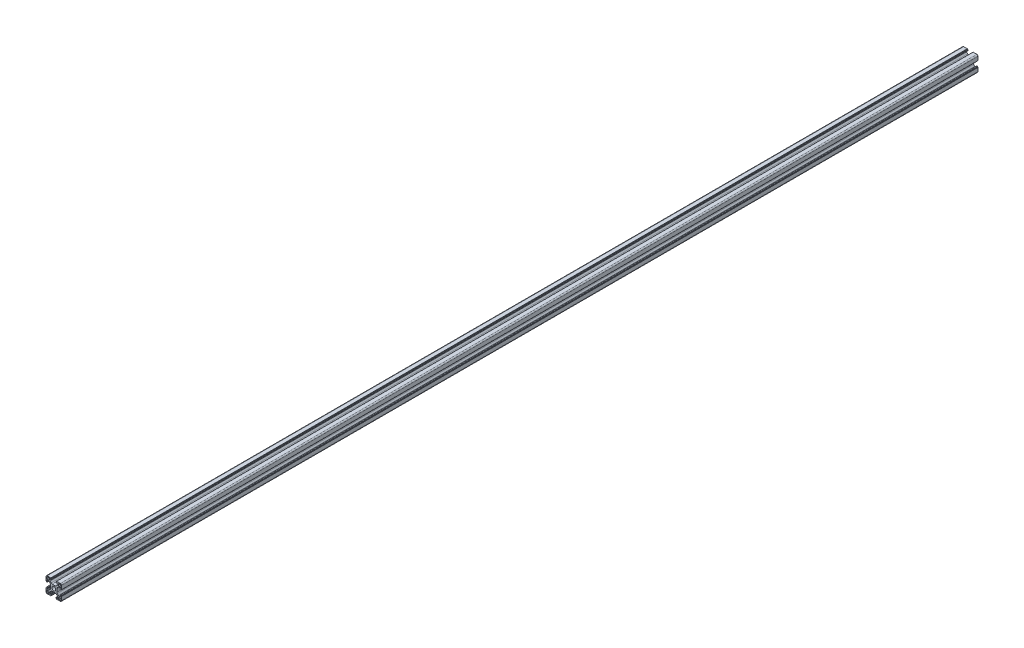
from build123d import *

# Parameters (mm, degrees)
EXTRUDE_1_DEPTH = 1180


with BuildPart() as part:
    # Эскиз1 → Бобышка-Вытянуть1 (new body)
    with BuildSketch(Plane.XY):
        with BuildLine():
            Line((-34.993325654, 64.172801362), (-33.094544985, 64.172801362))
            ThreePointArc((-33.094544985, 64.172801362), (-32.32917812, 64.325042297), (-31.680331423, 64.758587799))
            Line((-31.680331423, 64.758587799), (-30.379112092, 66.05980713))
            ThreePointArc((-30.379112092, 66.05980713), (-29.945566589, 66.708653828), (-29.793325654, 67.474020692))
            Line((-29.793325654, 67.474020692), (-29.793325654, 68.372801362))
            ThreePointArc((-29.793325654, 68.372801362), (-29.939772264, 68.726354752), (-30.293325654, 68.872801362))
            Line((-30.293325654, 68.872801362), (-30.396218873, 68.872801362))
            ThreePointArc((-30.396218873, 68.872801362), (-30.587560589, 68.834741128), (-30.749772264, 68.726354752))
            Line((-30.749772264, 68.726354752), (-31.23010235, 68.246024666))
            ThreePointArc((-31.23010235, 68.246024666), (-31.311208187, 68.191831478), (-31.406879045, 68.172801362))
            Line((-31.406879045, 68.172801362), (-31.693325654, 68.172801362))
            ThreePointArc((-31.693325654, 68.172801362), (-31.87010235, 68.246024666), (-31.943325654, 68.422801362))
            Line((-31.943325654, 68.422801362), (-31.943325654, 69.571872182))
            ThreePointArc((-31.943325654, 69.571872182), (-31.899391671, 69.677938199), (-31.793325654, 69.721872182))
            Line((-31.793325654, 69.721872182), (-31.293325654, 69.721872182))
            Line((-31.293325654, 69.721872182), (-31.293325654, 70.022801362))
            ThreePointArc((-31.293325654, 70.022801362), (-31.249391671, 70.128867379), (-31.143325654, 70.172801362))
            Line((-31.143325654, 70.172801362), (-26.493325654, 70.172801362))
            ThreePointArc((-26.493325654, 70.172801362), (-25.432665483, 69.733461533), (-24.993325654, 68.672801362))
            Line((-24.993325654, 68.672801362), (-24.993325654, 64.022801362))
            ThreePointArc((-24.993325654, 64.022801362), (-25.037259637, 63.916735344), (-25.143325654, 63.872801362))
            Line((-25.143325654, 63.872801362), (-25.444254834, 63.872801362))
            Line((-25.444254834, 63.872801362), (-25.444254834, 63.372801362))
            ThreePointArc((-25.444254834, 63.372801362), (-25.488188817, 63.266735344), (-25.594254834, 63.222801362))
            Line((-25.594254834, 63.222801362), (-26.743325654, 63.222801362))
            ThreePointArc((-26.743325654, 63.222801362), (-26.92010235, 63.296024666), (-26.993325654, 63.472801362))
            Line((-26.993325654, 63.472801362), (-26.993325654, 63.759247971))
            ThreePointArc((-26.993325654, 63.759247971), (-26.974295537, 63.854918829), (-26.92010235, 63.936024666))
            Line((-26.92010235, 63.936024666), (-26.439772264, 64.416354752))
            ThreePointArc((-26.439772264, 64.416354752), (-26.331385888, 64.578566427), (-26.293325654, 64.769908143))
            Line((-26.293325654, 64.769908143), (-26.293325654, 64.872801362))
            ThreePointArc((-26.293325654, 64.872801362), (-26.439772264, 65.226354752), (-26.793325654, 65.372801362))
            Line((-26.793325654, 65.372801362), (-27.692106323, 65.372801362))
            ThreePointArc((-27.692106323, 65.372801362), (-28.457473188, 65.220560427), (-29.106319886, 64.787014924))
            Line((-29.106319886, 64.787014924), (-30.407539217, 63.485795593))
            ThreePointArc((-30.407539217, 63.485795593), (-30.841084719, 62.836948895), (-30.993325654, 62.071582031))
            Line((-30.993325654, 62.071582031), (-30.993325654, 60.172801362))
            Line((-30.993325654, 60.172801362), (-30.993325654, 58.274020692))
            ThreePointArc((-30.993325654, 58.274020692), (-30.841084719, 57.508653828), (-30.407539217, 56.85980713))
            Line((-30.407539217, 56.85980713), (-29.106319886, 55.558587799))
            ThreePointArc((-29.106319886, 55.558587799), (-28.457473188, 55.125042297), (-27.692106323, 54.972801362))
            Line((-27.692106323, 54.972801362), (-26.793325654, 54.972801362))
            ThreePointArc((-26.793325654, 54.972801362), (-26.439772264, 55.119247971), (-26.293325654, 55.472801362))
            Line((-26.293325654, 55.472801362), (-26.293325654, 55.57569458))
            ThreePointArc((-26.293325654, 55.57569458), (-26.331385888, 55.767036297), (-26.439772264, 55.929247971))
            Line((-26.439772264, 55.929247971), (-26.92010235, 56.409578057))
            ThreePointArc((-26.92010235, 56.409578057), (-26.974295537, 56.490683894), (-26.993325654, 56.586354752))
            Line((-26.993325654, 56.586354752), (-26.993325654, 56.872801362))
            ThreePointArc((-26.993325654, 56.872801362), (-26.92010235, 57.049578057), (-26.743325654, 57.122801362))
            Line((-26.743325654, 57.122801362), (-25.594254834, 57.122801362))
            ThreePointArc((-25.594254834, 57.122801362), (-25.488188817, 57.078867379), (-25.444254834, 56.972801362))
            Line((-25.444254834, 56.972801362), (-25.444254834, 56.472801362))
            Line((-25.444254834, 56.472801362), (-25.143325654, 56.472801362))
            ThreePointArc((-25.143325654, 56.472801362), (-25.037259637, 56.428867379), (-24.993325654, 56.322801362))
            Line((-24.993325654, 56.322801362), (-24.993325654, 51.672801362))
            ThreePointArc((-24.993325654, 51.672801362), (-25.432665483, 50.61214119), (-26.493325654, 50.172801362))
            Line((-26.493325654, 50.172801362), (-31.143325654, 50.172801362))
            ThreePointArc((-31.143325654, 50.172801362), (-31.249391671, 50.216735344), (-31.293325654, 50.322801362))
            Line((-31.293325654, 50.322801362), (-31.293325654, 50.623730541))
            Line((-31.293325654, 50.623730541), (-31.793325654, 50.623730541))
            ThreePointArc((-31.793325654, 50.623730541), (-31.899391671, 50.667664524), (-31.943325654, 50.773730541))
            Line((-31.943325654, 50.773730541), (-31.943325654, 51.922801362))
            ThreePointArc((-31.943325654, 51.922801362), (-31.87010235, 52.099578057), (-31.693325654, 52.172801362))
            Line((-31.693325654, 52.172801362), (-31.406879045, 52.172801362))
            ThreePointArc((-31.406879045, 52.172801362), (-31.311208187, 52.153771245), (-31.23010235, 52.099578057))
            Line((-31.23010235, 52.099578057), (-30.749772264, 51.619247971))
            ThreePointArc((-30.749772264, 51.619247971), (-30.587560589, 51.510861595), (-30.396218873, 51.472801362))
            Line((-30.396218873, 51.472801362), (-30.293325654, 51.472801362))
            ThreePointArc((-30.293325654, 51.472801362), (-29.939772264, 51.619247971), (-29.793325654, 51.972801362))
            Line((-29.793325654, 51.972801362), (-29.793325654, 52.871582031))
            ThreePointArc((-29.793325654, 52.871582031), (-29.945566589, 53.636948895), (-30.379112092, 54.285795593))
            Line((-30.379112092, 54.285795593), (-31.680331423, 55.587014924))
            ThreePointArc((-31.680331423, 55.587014924), (-32.32917812, 56.020560427), (-33.094544985, 56.172801362))
            Line((-33.094544985, 56.172801362), (-34.993325654, 56.172801362))
            Line((-34.993325654, 56.172801362), (-36.892106323, 56.172801362))
            ThreePointArc((-36.892106323, 56.172801362), (-37.657473188, 56.020560427), (-38.306319886, 55.587014924))
            Line((-38.306319886, 55.587014924), (-39.607539217, 54.285795593))
            ThreePointArc((-39.607539217, 54.285795593), (-40.041084719, 53.636948895), (-40.193325654, 52.871582031))
            Line((-40.193325654, 52.871582031), (-40.193325654, 51.972801362))
            ThreePointArc((-40.193325654, 51.972801362), (-40.046879045, 51.619247971), (-39.693325654, 51.472801362))
            Line((-39.693325654, 51.472801362), (-39.590432436, 51.472801362))
            ThreePointArc((-39.590432436, 51.472801362), (-39.399090719, 51.510861595), (-39.236879045, 51.619247971))
            Line((-39.236879045, 51.619247971), (-38.756548959, 52.099578057))
            ThreePointArc((-38.756548959, 52.099578057), (-38.675443122, 52.153771245), (-38.579772264, 52.172801362))
            Line((-38.579772264, 52.172801362), (-38.293325654, 52.172801362))
            ThreePointArc((-38.293325654, 52.172801362), (-38.116548959, 52.099578057), (-38.043325654, 51.922801362))
            Line((-38.043325654, 51.922801362), (-38.043325654, 50.773730541))
            ThreePointArc((-38.043325654, 50.773730541), (-38.087259637, 50.667664524), (-38.193325654, 50.623730541))
            Line((-38.193325654, 50.623730541), (-38.693325654, 50.623730541))
            Line((-38.693325654, 50.623730541), (-38.693325654, 50.322801362))
            ThreePointArc((-38.693325654, 50.322801362), (-38.737259637, 50.216735344), (-38.843325654, 50.172801362))
            Line((-38.843325654, 50.172801362), (-43.493325654, 50.172801362))
            ThreePointArc((-43.493325654, 50.172801362), (-44.553985826, 50.61214119), (-44.993325654, 51.672801362))
            Line((-44.993325654, 51.672801362), (-44.993325654, 56.322801362))
            ThreePointArc((-44.993325654, 56.322801362), (-44.949391671, 56.428867379), (-44.843325654, 56.472801362))
            Line((-44.843325654, 56.472801362), (-44.542396475, 56.472801362))
            Line((-44.542396475, 56.472801362), (-44.542396475, 56.972801362))
            ThreePointArc((-44.542396475, 56.972801362), (-44.498462492, 57.078867379), (-44.392396475, 57.122801362))
            Line((-44.392396475, 57.122801362), (-43.243325654, 57.122801362))
            ThreePointArc((-43.243325654, 57.122801362), (-43.066548959, 57.049578057), (-42.993325654, 56.872801362))
            Line((-42.993325654, 56.872801362), (-42.993325654, 56.586354752))
            ThreePointArc((-42.993325654, 56.586354752), (-43.012355771, 56.490683894), (-43.066548959, 56.409578057))
            Line((-43.066548959, 56.409578057), (-43.546879045, 55.929247971))
            ThreePointArc((-43.546879045, 55.929247971), (-43.655265421, 55.767036297), (-43.693325654, 55.57569458))
            Line((-43.693325654, 55.57569458), (-43.693325654, 55.472801362))
            ThreePointArc((-43.693325654, 55.472801362), (-43.546879045, 55.119247971), (-43.193325654, 54.972801362))
            Line((-43.193325654, 54.972801362), (-42.294544985, 54.972801362))
            ThreePointArc((-42.294544985, 54.972801362), (-41.52917812, 55.125042297), (-40.880331423, 55.558587799))
            Line((-40.880331423, 55.558587799), (-39.579112092, 56.85980713))
            ThreePointArc((-39.579112092, 56.85980713), (-39.145566589, 57.508653828), (-38.993325654, 58.274020692))
            Line((-38.993325654, 58.274020692), (-38.993325654, 60.172801362))
            Line((-38.993325654, 60.172801362), (-38.993325654, 62.071582031))
            ThreePointArc((-38.993325654, 62.071582031), (-39.145566589, 62.836948895), (-39.579112092, 63.485795593))
            Line((-39.579112092, 63.485795593), (-40.880331423, 64.787014924))
            ThreePointArc((-40.880331423, 64.787014924), (-41.52917812, 65.220560427), (-42.294544985, 65.372801362))
            Line((-42.294544985, 65.372801362), (-43.193325654, 65.372801362))
            ThreePointArc((-43.193325654, 65.372801362), (-43.546879045, 65.226354752), (-43.693325654, 64.872801362))
            Line((-43.693325654, 64.872801362), (-43.693325654, 64.769908143))
            ThreePointArc((-43.693325654, 64.769908143), (-43.655265421, 64.578566427), (-43.546879045, 64.416354752))
            Line((-43.546879045, 64.416354752), (-43.066548959, 63.936024666))
            ThreePointArc((-43.066548959, 63.936024666), (-43.012355771, 63.854918829), (-42.993325654, 63.759247971))
            Line((-42.993325654, 63.759247971), (-42.993325654, 63.472801362))
            ThreePointArc((-42.993325654, 63.472801362), (-43.066548959, 63.296024666), (-43.243325654, 63.222801362))
            Line((-43.243325654, 63.222801362), (-44.392396475, 63.222801362))
            ThreePointArc((-44.392396475, 63.222801362), (-44.498462492, 63.266735344), (-44.542396475, 63.372801362))
            Line((-44.542396475, 63.372801362), (-44.542396475, 63.872801362))
            Line((-44.542396475, 63.872801362), (-44.843325654, 63.872801362))
            ThreePointArc((-44.843325654, 63.872801362), (-44.949391671, 63.916735344), (-44.993325654, 64.022801362))
            Line((-44.993325654, 64.022801362), (-44.993325654, 68.672801362))
            ThreePointArc((-44.993325654, 68.672801362), (-44.553985826, 69.733461533), (-43.493325654, 70.172801362))
            Line((-43.493325654, 70.172801362), (-38.843325654, 70.172801362))
            ThreePointArc((-38.843325654, 70.172801362), (-38.737259637, 70.128867379), (-38.693325654, 70.022801362))
            Line((-38.693325654, 70.022801362), (-38.693325654, 69.721872182))
            Line((-38.693325654, 69.721872182), (-38.193325654, 69.721872182))
            ThreePointArc((-38.193325654, 69.721872182), (-38.087259637, 69.677938199), (-38.043325654, 69.571872182))
            Line((-38.043325654, 69.571872182), (-38.043325654, 68.422801362))
            ThreePointArc((-38.043325654, 68.422801362), (-38.116548959, 68.246024666), (-38.293325654, 68.172801362))
            Line((-38.293325654, 68.172801362), (-38.579772264, 68.172801362))
            ThreePointArc((-38.579772264, 68.172801362), (-38.675443122, 68.191831478), (-38.756548959, 68.246024666))
            Line((-38.756548959, 68.246024666), (-39.236879045, 68.726354752))
            ThreePointArc((-39.236879045, 68.726354752), (-39.399090719, 68.834741128), (-39.590432436, 68.872801362))
            Line((-39.590432436, 68.872801362), (-39.693325654, 68.872801362))
            ThreePointArc((-39.693325654, 68.872801362), (-40.046879045, 68.726354752), (-40.193325654, 68.372801362))
            Line((-40.193325654, 68.372801362), (-40.193325654, 67.474020692))
            ThreePointArc((-40.193325654, 67.474020692), (-40.041084719, 66.708653828), (-39.607539217, 66.05980713))
            Line((-39.607539217, 66.05980713), (-38.306319886, 64.758587799))
            ThreePointArc((-38.306319886, 64.758587799), (-37.657473188, 64.325042297), (-36.892106323, 64.172801362))
            Line((-36.892106323, 64.172801362), (-34.993325654, 64.172801362))
        make_face()
        with BuildLine():
            Line((-28.093325654, 66.272801362), (-26.693325654, 66.272801362))
            ThreePointArc((-26.693325654, 66.272801362), (-26.127640229, 66.507115937), (-25.893325654, 67.072801362))
            Line((-25.893325654, 67.072801362), (-25.893325654, 68.472801362))
            ThreePointArc((-25.893325654, 68.472801362), (-26.127640229, 69.038486787), (-26.693325654, 69.272801362))
            Line((-26.693325654, 69.272801362), (-28.093325654, 69.272801362))
            ThreePointArc((-28.093325654, 69.272801362), (-28.659011079, 69.038486787), (-28.893325654, 68.472801362))
            Line((-28.893325654, 68.472801362), (-28.893325654, 67.072801362))
            ThreePointArc((-28.893325654, 67.072801362), (-28.659011079, 66.507115937), (-28.093325654, 66.272801362))
        make_face(mode=Mode.SUBTRACT)
        with BuildLine():
            Line((-28.893325654, 53.272801362), (-28.893325654, 51.872801362))
            ThreePointArc((-28.893325654, 51.872801362), (-28.659011079, 51.307115937), (-28.093325654, 51.072801362))
            Line((-28.093325654, 51.072801362), (-26.693325654, 51.072801362))
            ThreePointArc((-26.693325654, 51.072801362), (-26.127640229, 51.307115937), (-25.893325654, 51.872801362))
            Line((-25.893325654, 51.872801362), (-25.893325654, 53.272801362))
            ThreePointArc((-25.893325654, 53.272801362), (-26.127640229, 53.838486787), (-26.693325654, 54.072801362))
            Line((-26.693325654, 54.072801362), (-28.093325654, 54.072801362))
            ThreePointArc((-28.093325654, 54.072801362), (-28.659011079, 53.838486787), (-28.893325654, 53.272801362))
        make_face(mode=Mode.SUBTRACT)
        with BuildLine():
            Line((-41.893325654, 54.072801362), (-43.293325654, 54.072801362))
            ThreePointArc((-43.293325654, 54.072801362), (-43.859011079, 53.838486787), (-44.093325654, 53.272801362))
            Line((-44.093325654, 53.272801362), (-44.093325654, 51.872801362))
            ThreePointArc((-44.093325654, 51.872801362), (-43.859011079, 51.307115937), (-43.293325654, 51.072801362))
            Line((-43.293325654, 51.072801362), (-41.893325654, 51.072801362))
            ThreePointArc((-41.893325654, 51.072801362), (-41.327640229, 51.307115937), (-41.093325654, 51.872801362))
            Line((-41.093325654, 51.872801362), (-41.093325654, 53.272801362))
            ThreePointArc((-41.093325654, 53.272801362), (-41.327640229, 53.838486787), (-41.893325654, 54.072801362))
        make_face(mode=Mode.SUBTRACT)
        with BuildLine():
            Line((-41.093325654, 67.072801362), (-41.093325654, 68.472801362))
            ThreePointArc((-41.093325654, 68.472801362), (-41.327640229, 69.038486787), (-41.893325654, 69.272801362))
            Line((-41.893325654, 69.272801362), (-43.293325654, 69.272801362))
            ThreePointArc((-43.293325654, 69.272801362), (-43.859011079, 69.038486787), (-44.093325654, 68.472801362))
            Line((-44.093325654, 68.472801362), (-44.093325654, 67.072801362))
            ThreePointArc((-44.093325654, 67.072801362), (-43.859011079, 66.507115937), (-43.293325654, 66.272801362))
            Line((-43.293325654, 66.272801362), (-41.893325654, 66.272801362))
            ThreePointArc((-41.893325654, 66.272801362), (-41.327640229, 66.507115937), (-41.093325654, 67.072801362))
        make_face(mode=Mode.SUBTRACT)
        with BuildLine():
            ThreePointArc((-32.493325654, 60.172801362), (-33.225558701, 61.940568315), (-34.993325654, 62.672801362))
            ThreePointArc((-34.993325654, 62.672801362), (-36.761092607, 61.940568315), (-37.493325654, 60.172801362))
            ThreePointArc((-37.493325654, 60.172801362), (-36.761092607, 58.405034409), (-34.993325654, 57.672801362))
            ThreePointArc((-34.993325654, 57.672801362), (-33.225558701, 58.405034409), (-32.493325654, 60.172801362))
        make_face(mode=Mode.SUBTRACT)
    extrude(amount=EXTRUDE_1_DEPTH)


solid = part.part
